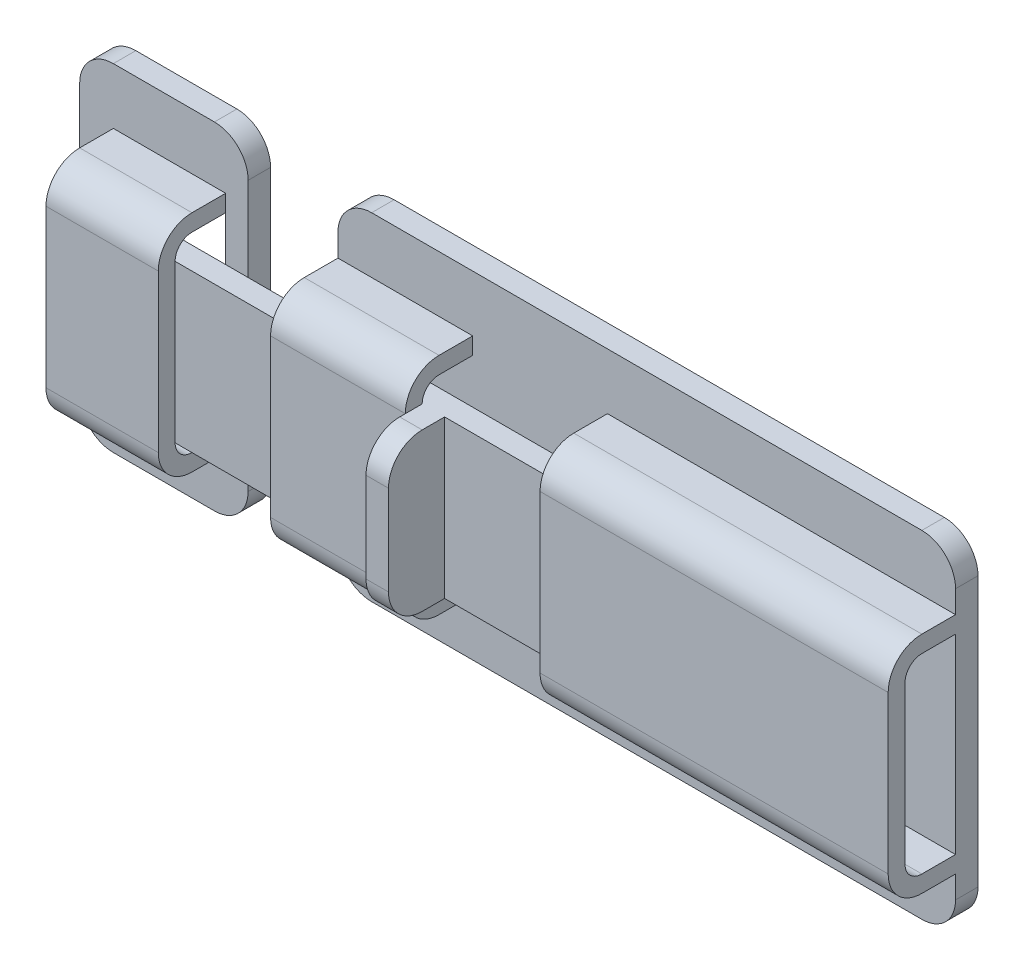
from build123d import *

# Parameters (mm, degrees)
SKETCH_1_W          = 15
SKETCH_1_H          = 30
EXTRUDE_1_DEPTH     = 2
EXTRUDE_2_DEPTH     = 10
FILLET_1_R          = 1.5
SKETCH_3_W          = 10
SKETCH_3_H          = 17
CUT_EXTRUDE_1_DEPTH = 3
SKETCH_4_W          = 55
SKETCH_4_H          = 30
EXTRUDE_3_DEPTH     = 2
SKETCH_5_W          = 47
SKETCH_5_H          = 14
EXTRUDE_4_DEPTH     = 2
SKETCH_6_W          = 2
SKETCH_6_H          = 5
EXTRUDE_5_DEPTH     = 14
EXTRUDE_6_DEPTH     = 12
EXTRUDE_7_DEPTH     = 31
FILLET_4_R          = 3


with BuildPart() as part:
    # 草图1 → 凸台-拉伸1 (new body)
    with BuildSketch(Plane.XY):
        Rectangle(SKETCH_1_W, SKETCH_1_H)
    extrude(amount=EXTRUDE_1_DEPTH)

    # 草图2 → 凸台-拉伸2 (add)
    with BuildSketch(Plane(origin=(5.5, 0, 0), x_dir=(0, 0, -1), z_dir=(1, 0, 0))):
        Polygon((-2, 10), (-8, 10), (-8, -10), (-2, -10), (-2, -8.5), (-6.5, -8.5), (-6.5, 8.5), (-2, 8.5), align=None)
    extrude(amount=-EXTRUDE_2_DEPTH)

    # 圆角1
    fillet_1_edges = [part.edges().sort_by_distance(p)[0] for p in [
        (0.5, 8.5, 6.5),
        (0.5, -8.5, 6.5),
    ]]
    fillet(fillet_1_edges, radius=FILLET_1_R)

    # 草图3 → 切除-拉伸1 (cut)
    with BuildSketch(Plane(origin=(0, 0, 0), x_dir=(-1, 0, 0), z_dir=(0, 0, -1))):
        with Locations((-0.5, 0)):
            Rectangle(SKETCH_3_W, SKETCH_3_H)
    extrude(amount=-CUT_EXTRUDE_1_DEPTH, mode=Mode.SUBTRACT)

    # 草图5 → 凸台-拉伸4 (add)
    with BuildSketch(Plane(origin=(0, 0, 6.5), x_dir=(-1, 0, 0), z_dir=(0, 0, -1))):
        with Locations((-21, 0)):
            Rectangle(SKETCH_5_W, SKETCH_5_H)
    extrude(amount=EXTRUDE_4_DEPTH)

    # 草图6 → 凸台-拉伸5 (add)
    with BuildSketch(Plane.XZ.offset(7)):
        with Locations((28.5, 9)):
            Rectangle(SKETCH_6_W, SKETCH_6_H)
    extrude(amount=-EXTRUDE_5_DEPTH)



with BuildPart() as body_2:
    # 草图4 → 凸台-拉伸3 (new body)
    with BuildSketch(Plane.XY.offset(2)):
        with Locations((43, 0)):
            Rectangle(SKETCH_4_W, SKETCH_4_H)
    extrude(amount=-EXTRUDE_3_DEPTH)


with BuildPart() as part_1:
    add(part.part)

    add(body_2.part)  # 凸台-拉伸6 merges body 2
    # 草图7 → 凸台-拉伸6 (add)
    with BuildSketch(Plane.ZY.offset(-15.5)):
        with BuildLine():
            Line((6.5, -7), (6.5, 7))
            ThreePointArc((6.5, 7), (6.060660172, 8.060660172), (5, 8.5))
            Line((5, 8.5), (2, 8.5))
            Line((2, 8.5), (2, 10))
            Line((2, 10), (8, 10))
            Line((8, 10), (8, -10))
            Line((8, -10), (2, -10))
            Line((2, -10), (2, -8.5))
            Line((2, -8.5), (5, -8.5))
            ThreePointArc((5, -8.5), (6.060660172, -8.060660172), (6.5, -7))
        make_face()
    extrude(amount=-EXTRUDE_6_DEPTH)

    # 草图8 → 凸台-拉伸7 (add)
    with BuildSketch(Plane(origin=(39.5, 0, 0), x_dir=(0, 0, -1), z_dir=(1, 0, 0))):
        with BuildLine():
            Line((-6.5, 7), (-6.5, -7))
            ThreePointArc((-6.5, -7), (-6.060660172, -8.060660172), (-5, -8.5))
            Line((-5, -8.5), (-2, -8.5))
            Line((-2, -8.5), (-2, -10))
            Line((-2, -10), (-8, -10))
            Line((-8, -10), (-8, 10))
            Line((-8, 10), (-2, 10))
            Line((-2, 10), (-2, 8.5))
            Line((-2, 8.5), (-5, 8.5))
            ThreePointArc((-5, 8.5), (-6.060660172, 8.060660172), (-6.5, 7))
        make_face()
    extrude(amount=EXTRUDE_7_DEPTH)

    # 圆角4
    fillet_4_edges = [part_1.edges().sort_by_distance(p)[0] for p in [
        (-7.5, -15, 1),
        (-7.5, 15, 1),
        (7.5, 15, 1),
        (15.5, 15, 1),
        (70.5, 15, 1),
        (7.5, -15, 1),
        (15.5, -15, 1),
        (70.5, -15, 1),
        (28.5, -7, 11.5),
        (28.5, 7, 11.5),
        (55, 10, 8),
        (55, -10, 8),
        (21.5, -10, 8),
        (21.5, 10, 8),
        (0.5, -10, 8),
        (0.5, 10, 8),
    ]]
    fillet(fillet_4_edges, radius=FILLET_4_R)


solid = part_1.part
